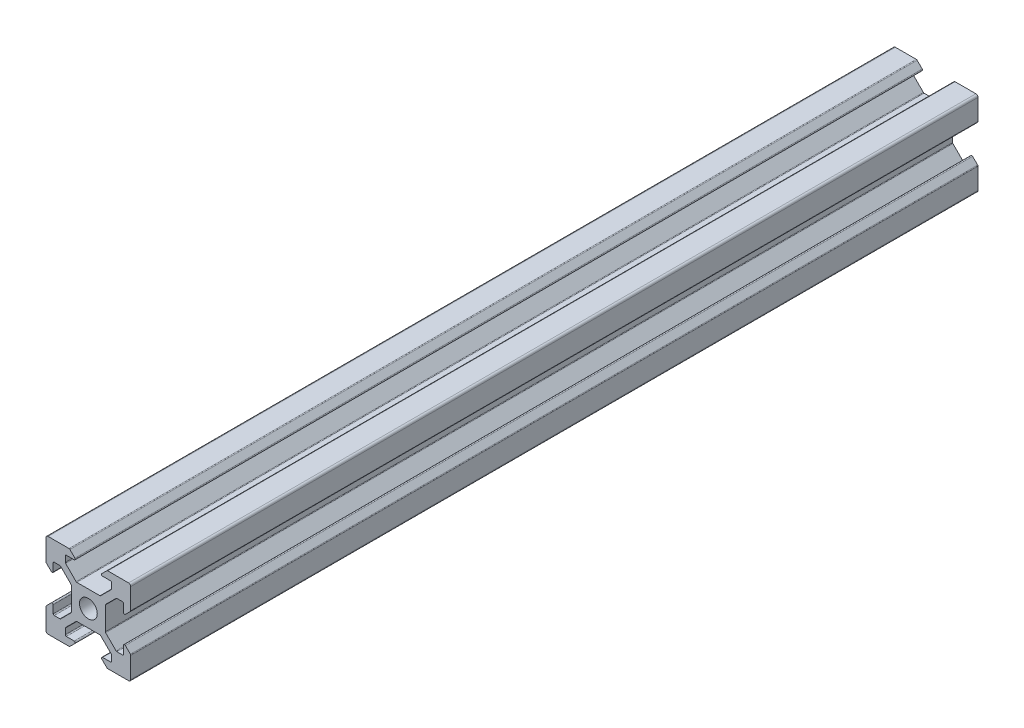
from build123d import *

# Parameters (mm, degrees)
MODEL_R             = 2.1
BOSS_EXTRUDE1_DEPTH = 200


with BuildPart() as part:
    # Model → Boss-Extrude1 (new body)
    with BuildSketch(Plane.XY):
        with BuildLine():
            Line((2012.931211125, 1381.800393717), (2012.931211125, 1378.200393717))
            Line((2012.931211125, 1378.200393717), (2012.931211125, 1377.300429431))
            ThreePointArc((2012.931211125, 1377.300429431), (2012.908374985, 1377.185624401), (2012.843343159, 1377.088297396))
            Line((2012.843343159, 1377.088297396), (2010.378662785, 1374.623617022))
            ThreePointArc((2010.378662785, 1374.623617022), (2010.297556948, 1374.569423834), (2010.20188609, 1374.550393717))
            Line((2010.20188609, 1374.550393717), (2008.881211125, 1374.550393717))
            ThreePointArc((2008.881211125, 1374.550393717), (2008.70443443, 1374.623617022), (2008.631211125, 1374.800393717))
            Line((2008.631211125, 1374.800393717), (2008.631211125, 1376.650393717))
            ThreePointArc((2008.631211125, 1376.650393717), (2008.476881983, 1376.8813636), (2008.20443443, 1376.827170412))
            Line((2008.20443443, 1376.827170412), (2007.01907909, 1375.641815073))
            ThreePointArc((2007.01907909, 1375.641815073), (2006.954047265, 1375.544488069), (2006.931211125, 1375.429683039))
            Line((2006.931211125, 1375.429683039), (2006.931211125, 1370.500393717))
            ThreePointArc((2006.931211125, 1370.500393717), (2007.077657734, 1370.146840327), (2007.431211125, 1370.000393717))
            Line((2007.431211125, 1370.000393717), (2012.360500447, 1370.000393717))
            ThreePointArc((2012.360500447, 1370.000393717), (2012.475305476, 1370.023229857), (2012.572632481, 1370.088261683))
            Line((2012.572632481, 1370.088261683), (2013.75798782, 1371.273617022))
            ThreePointArc((2013.75798782, 1371.273617022), (2013.812181008, 1371.546064575), (2013.581211125, 1371.700393717))
            Line((2013.581211125, 1371.700393717), (2011.731211125, 1371.700393717))
            ThreePointArc((2011.731211125, 1371.700393717), (2011.55443443, 1371.773617022), (2011.481211125, 1371.950393717))
            Line((2011.481211125, 1371.950393717), (2011.481211125, 1373.271068682))
            ThreePointArc((2011.481211125, 1373.271068682), (2011.500241242, 1373.36673954), (2011.55443443, 1373.447845377))
            Line((2011.55443443, 1373.447845377), (2014.033759465, 1375.927170412))
            ThreePointArc((2014.033759465, 1375.927170412), (2014.114865302, 1375.9813636), (2014.21053616, 1376.000393717))
            Line((2014.21053616, 1376.000393717), (2016.470233902, 1376.000393717))
            Line((2016.470233902, 1376.000393717), (2017.392188348, 1376.000393717))
            Line((2017.392188348, 1376.000393717), (2019.65188609, 1376.000393717))
            ThreePointArc((2019.65188609, 1376.000393717), (2019.747556948, 1375.9813636), (2019.828662785, 1375.927170412))
            Line((2019.828662785, 1375.927170412), (2022.30798782, 1373.447845377))
            ThreePointArc((2022.30798782, 1373.447845377), (2022.362181008, 1373.36673954), (2022.381211125, 1373.271068682))
            Line((2022.381211125, 1373.271068682), (2022.381211125, 1371.950393717))
            ThreePointArc((2022.381211125, 1371.950393717), (2022.30798782, 1371.773617022), (2022.131211125, 1371.700393717))
            Line((2022.131211125, 1371.700393717), (2020.281211125, 1371.700393717))
            ThreePointArc((2020.281211125, 1371.700393717), (2020.050241242, 1371.546064575), (2020.10443443, 1371.273617022))
            Line((2020.10443443, 1371.273617022), (2021.289789769, 1370.088261683))
            ThreePointArc((2021.289789769, 1370.088261683), (2021.387116773, 1370.023229857), (2021.501921803, 1370.000393717))
            Line((2021.501921803, 1370.000393717), (2026.431211125, 1370.000393717))
            ThreePointArc((2026.431211125, 1370.000393717), (2026.784764515, 1370.146840327), (2026.931211125, 1370.500393717))
            Line((2026.931211125, 1370.500393717), (2026.931211125, 1375.429683039))
            ThreePointArc((2026.931211125, 1375.429683039), (2026.908374985, 1375.544488069), (2026.843343159, 1375.641815073))
            Line((2026.843343159, 1375.641815073), (2025.65798782, 1376.827170412))
            ThreePointArc((2025.65798782, 1376.827170412), (2025.385540267, 1376.8813636), (2025.231211125, 1376.650393717))
            Line((2025.231211125, 1376.650393717), (2025.231211125, 1374.800393717))
            ThreePointArc((2025.231211125, 1374.800393717), (2025.15798782, 1374.623617022), (2024.981211125, 1374.550393717))
            Line((2024.981211125, 1374.550393717), (2023.66053616, 1374.550393717))
            ThreePointArc((2023.66053616, 1374.550393717), (2023.564865302, 1374.569423834), (2023.483759465, 1374.623617022))
            Line((2023.483759465, 1374.623617022), (2021.00443443, 1377.102942057))
            ThreePointArc((2021.00443443, 1377.102942057), (2020.950241242, 1377.184047894), (2020.931211125, 1377.279718752))
            Line((2020.931211125, 1377.279718752), (2020.931211125, 1379.539416494))
            Line((2020.931211125, 1379.539416494), (2020.931211125, 1380.46137094))
            Line((2020.931211125, 1380.46137094), (2020.931211125, 1382.721068682))
            ThreePointArc((2020.931211125, 1382.721068682), (2020.950241242, 1382.81673954), (2021.00443443, 1382.897845377))
            Line((2021.00443443, 1382.897845377), (2023.483759465, 1385.377170412))
            ThreePointArc((2023.483759465, 1385.377170412), (2023.564865302, 1385.4313636), (2023.66053616, 1385.450393717))
            Line((2023.66053616, 1385.450393717), (2024.981211125, 1385.450393717))
            ThreePointArc((2024.981211125, 1385.450393717), (2025.15798782, 1385.377170412), (2025.231211125, 1385.200393717))
            Line((2025.231211125, 1385.200393717), (2025.231211125, 1383.350393717))
            ThreePointArc((2025.231211125, 1383.350393717), (2025.385540267, 1383.119423834), (2025.65798782, 1383.173617022))
            Line((2025.65798782, 1383.173617022), (2026.843343159, 1384.358972361))
            ThreePointArc((2026.843343159, 1384.358972361), (2026.908374985, 1384.456299366), (2026.931211125, 1384.571104395))
            Line((2026.931211125, 1384.571104395), (2026.931211125, 1389.500393717))
            ThreePointArc((2026.931211125, 1389.500393717), (2026.784764516, 1389.853947108), (2026.431211125, 1390.000393717))
            Line((2026.431211125, 1390.000393717), (2021.501921803, 1390.000393717))
            ThreePointArc((2021.501921803, 1390.000393717), (2021.387116773, 1389.977557577), (2021.289789769, 1389.912525752))
            Line((2021.289789769, 1389.912525752), (2020.10443443, 1388.727170413))
            ThreePointArc((2020.10443443, 1388.727170413), (2020.050241242, 1388.454722859), (2020.281211125, 1388.300393717))
            Line((2020.281211125, 1388.300393717), (2022.131211125, 1388.300393717))
            ThreePointArc((2022.131211125, 1388.300393717), (2022.30798782, 1388.227170413), (2022.381211125, 1388.050393717))
            Line((2022.381211125, 1388.050393717), (2022.381211125, 1386.729718752))
            ThreePointArc((2022.381211125, 1386.729718752), (2022.362181008, 1386.634047894), (2022.30798782, 1386.552942057))
            Line((2022.30798782, 1386.552942057), (2019.828662785, 1384.073617022))
            ThreePointArc((2019.828662785, 1384.073617022), (2019.747556948, 1384.019423834), (2019.65188609, 1384.000393717))
            Line((2019.65188609, 1384.000393717), (2017.392188348, 1384.000393717))
            Line((2017.392188348, 1384.000393717), (2016.470233902, 1384.000393717))
            Line((2016.470233902, 1384.000393717), (2014.21053616, 1384.000393717))
            ThreePointArc((2014.21053616, 1384.000393717), (2014.114865302, 1384.019423834), (2014.033759465, 1384.073617022))
            Line((2014.033759465, 1384.073617022), (2011.55443443, 1386.552942057))
            ThreePointArc((2011.55443443, 1386.552942057), (2011.500241242, 1386.634047894), (2011.481211125, 1386.729718752))
            Line((2011.481211125, 1386.729718752), (2011.481211125, 1388.050393717))
            ThreePointArc((2011.481211125, 1388.050393717), (2011.55443443, 1388.227170413), (2011.731211125, 1388.300393717))
            Line((2011.731211125, 1388.300393717), (2013.581211125, 1388.300393717))
            ThreePointArc((2013.581211125, 1388.300393717), (2013.812181008, 1388.454722859), (2013.75798782, 1388.727170413))
            Line((2013.75798782, 1388.727170413), (2012.572632481, 1389.912525752))
            ThreePointArc((2012.572632481, 1389.912525752), (2012.475305477, 1389.977557577), (2012.360500447, 1390.000393717))
            Line((2012.360500447, 1390.000393717), (2007.431211125, 1390.000393717))
            ThreePointArc((2007.431211125, 1390.000393717), (2007.077657734, 1389.853947108), (2006.931211125, 1389.500393717))
            Line((2006.931211125, 1389.500393717), (2006.931211125, 1384.571104395))
            ThreePointArc((2006.931211125, 1384.571104395), (2006.954047265, 1384.456299366), (2007.019079091, 1384.358972361))
            Line((2007.019079091, 1384.358972361), (2008.20443443, 1383.173617022))
            ThreePointArc((2008.20443443, 1383.173617022), (2008.476881983, 1383.119423834), (2008.631211125, 1383.350393717))
            Line((2008.631211125, 1383.350393717), (2008.631211125, 1385.200393717))
            ThreePointArc((2008.631211125, 1385.200393717), (2008.70443443, 1385.377170412), (2008.881211125, 1385.450393717))
            Line((2008.881211125, 1385.450393717), (2010.20188609, 1385.450393717))
            ThreePointArc((2010.20188609, 1385.450393717), (2010.297556948, 1385.4313636), (2010.378662785, 1385.377170412))
            Line((2010.378662785, 1385.377170412), (2012.843343159, 1382.912490038))
            ThreePointArc((2012.843343159, 1382.912490038), (2012.908374985, 1382.815163033), (2012.931211125, 1382.700358004))
            Line((2012.931211125, 1382.700358004), (2012.931211125, 1381.800393717))
        make_face()
        with Locations((2016.931211125, 1380.000393717)):
            Circle(MODEL_R, mode=Mode.SUBTRACT)
    extrude(amount=BOSS_EXTRUDE1_DEPTH)


solid = part.part
